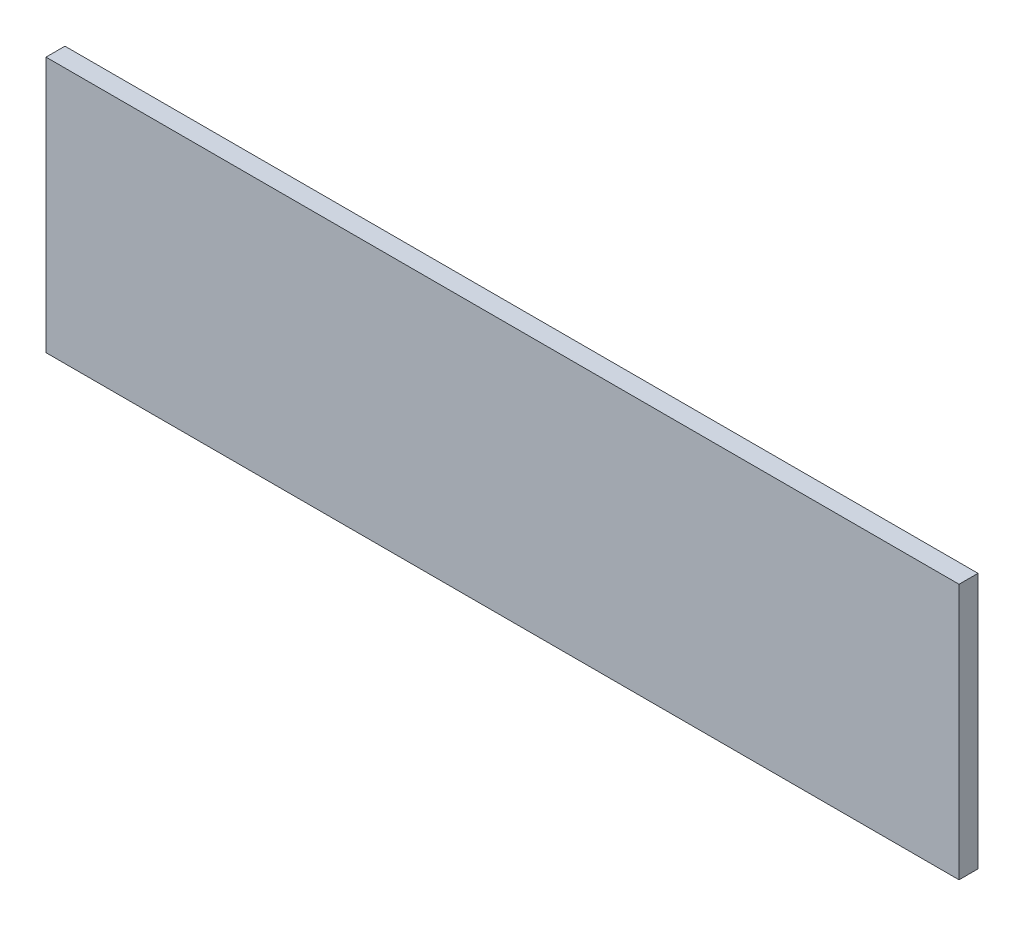
from build123d import *

# Parameters (mm, degrees)
SKETCH_1_W      = 159
SKETCH_1_H      = 44.58
EXTRUDE_1_DEPTH = 3.3


with BuildPart() as part:
    # Эскиз1 → Бобышка-Вытянуть1 (new body)
    with BuildSketch(Plane.XY):
        with Locations((79.5, 22.29)):
            Rectangle(SKETCH_1_W, SKETCH_1_H)
    extrude(amount=EXTRUDE_1_DEPTH)


solid = part.part
